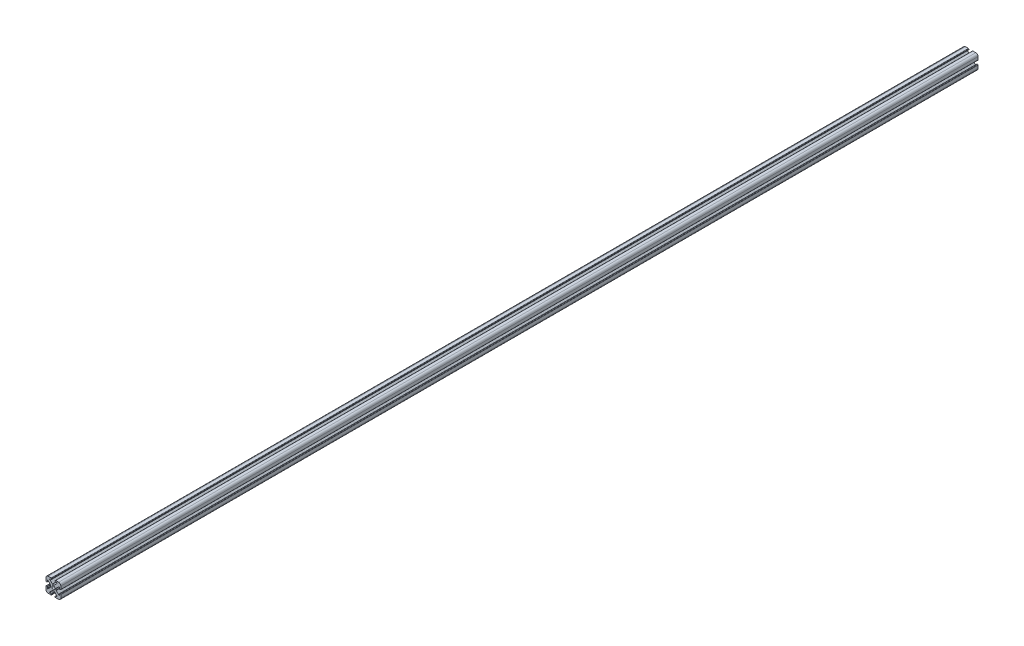
from build123d import *

# Parameters (mm, degrees)
SKETCH1_W           = 7.3
SKETCH1_H           = 7.3
SKETCH1_R           = 2.15
BOSS_EXTRUDE1_DEPTH = 1240
BOSS_EXTRUDE2_DEPTH = 1240
FILLET4_R           = 3
FILLET5_R           = 0.5
FILLET6_R           = 0.5
FILLET7_R           = 0.5
SKETCH5_R           = 2.15
CUT_EXTRUDE3_DEPTH  = 1241.115447247
SKETCH6_R           = 2.15
CUT_EXTRUDE4_DEPTH  = 1241.115447347


with BuildPart() as part:
    # Sketch1 → Boss-Extrude1 (new body)
    with BuildSketch(Plane.XY):
        Rectangle(SKETCH1_W, SKETCH1_H)
        Circle(SKETCH1_R, mode=Mode.SUBTRACT)
    extrude(amount=BOSS_EXTRUDE1_DEPTH)

    # Sketch2 → Boss-Extrude2 (add)
    with BuildSketch(Plane.XY):
        Polygon((3.65, 3.65), (1.2, 3.65), (5.750000001, 8.200000001), (2.500000001, 8.200000001), (2.500000001, 10.000000001), (10.000000001, 10.000000001), (10.000000001, 2.500000001), (8.200000001, 2.500000001), (8.200000001, 5.750000001), (3.65, 1.2), align=None)
        Polygon((-3.65, 3.65), (-1.2, 3.65), (-5.750000001, 8.200000001), (-2.500000001, 8.200000001), (-2.500000001, 10.000000001), (-10.000000001, 10.000000001), (-10.000000001, 2.500000001), (-8.200000001, 2.500000001), (-8.200000001, 5.750000001), (-3.65, 1.2), align=None)
        Polygon((-3.65, -3.65), (-3.65, -1.2), (-8.200000001, -5.750000001), (-8.200000001, -2.500000001), (-10.000000001, -2.500000001), (-10.000000001, -10.000000001), (-2.500000001, -10.000000001), (-2.500000001, -8.200000001), (-5.750000001, -8.200000001), (-1.2, -3.65), align=None)
        Polygon((3.65, -3.65), (3.65, -1.2), (8.200000001, -5.750000001), (8.200000001, -2.500000001), (10.000000001, -2.500000001), (10.000000001, -10.000000001), (2.500000001, -10.000000001), (2.500000001, -8.200000001), (5.750000001, -8.200000001), (1.2, -3.65), align=None)
    extrude(amount=BOSS_EXTRUDE2_DEPTH)

    # Fillet4
    fillet4_edges = [part.edges().sort_by_distance(p)[0] for p in [
        (10.000000001, 10.000000001, 620),
        (-10.000000001, 10.000000001, 620),
        (-10.000000001, -10.000000001, 620),
        (10.000000001, -10.000000001, 620),
    ]]
    fillet(fillet4_edges, radius=FILLET4_R)

    # Fillet5
    fillet5_edges = [part.edges().sort_by_distance(p)[0] for p in [
        (8.200000001, 2.500000001, 620),
        (10.000000001, 2.500000001, 620),
        (2.500000001, 10.000000001, 620),
        (2.500000001, 8.200000001, 620),
        (-2.500000001, 8.200000001, 620),
        (-2.500000001, 10.000000001, 620),
        (-10.000000001, 2.500000001, 620),
        (-8.200000001, 2.500000001, 620),
        (-8.200000001, -2.500000001, 620),
        (-10.000000001, -2.500000001, 620),
        (-2.500000001, -10.000000001, 620),
        (-2.500000001, -8.200000001, 620),
        (2.500000001, -8.200000001, 620),
        (10.000000001, -2.500000001, 620),
        (8.200000001, -2.500000001, 620),
    ]]
    fillet(fillet5_edges, radius=FILLET5_R)

    # Fillet6
    fillet6_edges = [part.edges().sort_by_distance(p)[0] for p in [
        (3.65, 1.2, 620),
        (1.2, 3.65, 620),
        (-3.65, 1.2, 620),
        (-1.2, 3.65, 620),
        (-1.2, -3.65, 620),
        (-3.65, -1.2, 620),
        (1.2, -3.65, 620),
        (3.65, -1.2, 620),
    ]]
    fillet(fillet6_edges, radius=FILLET6_R)

    # Fillet7
    fillet7_edges = [part.edges().sort_by_distance(p)[0] for p in [
        (8.200000001, 5.750000001, 620),
        (5.750000001, 8.200000001, 620),
        (-5.750000001, 8.200000001, 620),
        (-8.200000001, 5.750000001, 620),
        (-8.200000001, -5.750000001, 620),
        (-5.750000001, -8.200000001, 620),
        (5.750000001, -8.200000001, 620),
        (8.200000001, -5.750000001, 620),
    ]]
    fillet(fillet7_edges, radius=FILLET7_R)

    # Sketch5 → Cut-Extrude3 (cut, through all)
    with BuildSketch(Plane.ZY.offset(3.65)):
        with Locations(Location((1230, 0, 0), (0, 0, 270))):
            Circle(SKETCH5_R)
    extrude(amount=-CUT_EXTRUDE3_DEPTH, mode=Mode.SUBTRACT)

    # Sketch6 → Cut-Extrude4 (cut, through all)
    with BuildSketch(Plane(origin=(3.65, 0, 0), x_dir=(0, 0, -1), z_dir=(1, 0, 0))):
        with Locations(Location((-1230, 0, 0), (0, 0, 270))):
            Circle(SKETCH6_R)
    extrude(amount=-CUT_EXTRUDE4_DEPTH, mode=Mode.SUBTRACT)


solid = part.part
